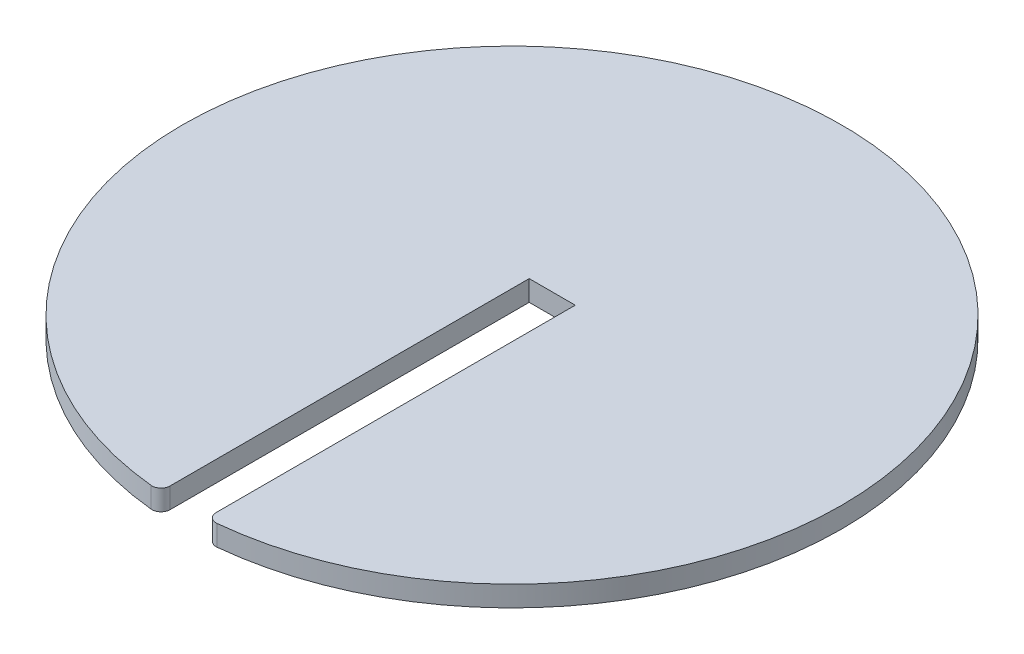
from build123d import *

# Parameters (mm, degrees)
BOSS_EXTRUDE1_DEPTH = 1.5875
FILLET1_R           = 0.7


with BuildPart() as part:
    # Sketch1 → Boss-Extrude1 (new body)
    with BuildSketch(Plane(origin=(0, 0, 0), x_dir=(1, 0, 0), z_dir=(0, 1, 0))):
        with BuildLine():
            Line((2.408495171, 1.948589223), (2.408495171, -20.289314696))
            ThreePointArc((2.408495171, -20.289314696), (4.183495171, 30.448589223), (5.958495171, -20.289314696))
            Line((5.958495171, -20.289314696), (5.958495171, 1.948589223))
            Line((5.958495171, 1.948589223), (5.958495171, 8.148589223))
            Line((5.958495171, 8.148589223), (2.408495171, 8.148589223))
            Line((2.408495171, 8.148589223), (2.408495171, 1.948589223))
        make_face()
    extrude(amount=BOSS_EXTRUDE1_DEPTH)

    # Fillet1
    fillet1_edges = [part.edges().sort_by_distance(p)[0] for p in [
        (2.408495171, 0.79375, 20.289314696),
        (5.958495171, 0.79375, 20.289314696),
    ]]
    fillet(fillet1_edges, radius=FILLET1_R)


solid = part.part
